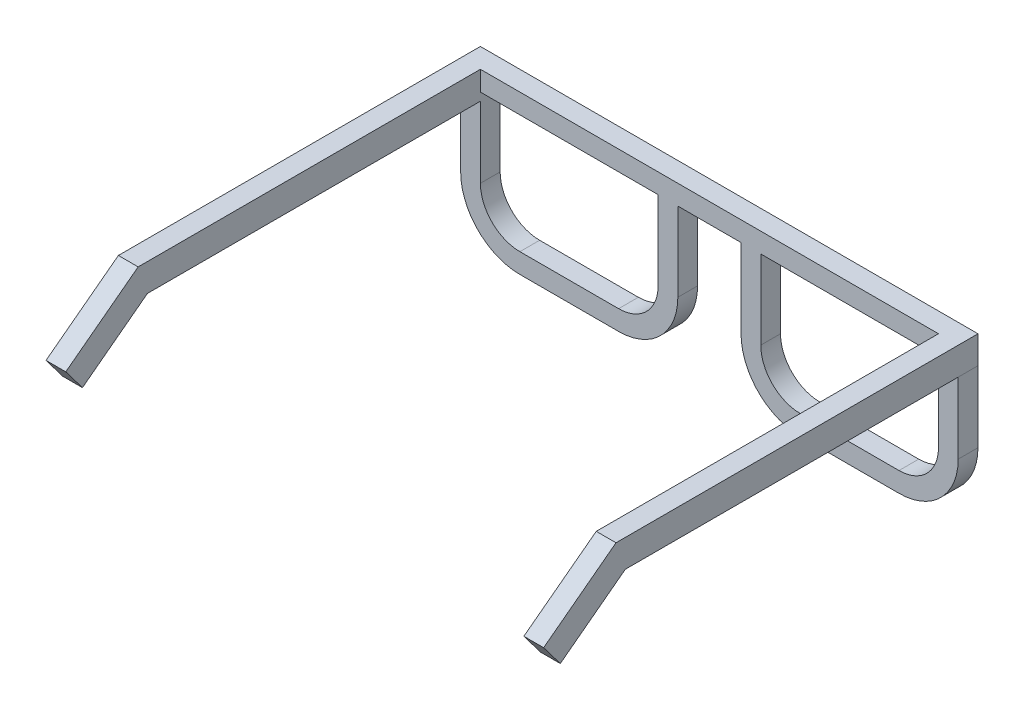
from build123d import *

# Parameters (mm, degrees)
SKETCH_1_W      = 55
SKETCH_1_H      = 40
SKETCH_1_W_2    = 45
SKETCH_1_H_2    = 30
SKETCH_1_W_3    = 16
SKETCH_1_H_3    = 5
EXTRUDE_1_DEPTH = 5
FILLET_1_R      = 10
FILLET_2_R      = 15
EXTRUDE_START   = -5
SKETCH_2_W      = 5
SKETCH_2_H      = 7
EXTRUDE_2_DEPTH = 5.01
FILLET_3_R      = 15


with BuildPart() as part:
    # ｽｹｯﾁ1 → ﾎﾞｽ - 押し出し1 (new body)
    # profile 1 of 3: a face of its own
    with BuildSketch(Plane.XY):
        with Locations((35.5, 1.53340789)):
            Rectangle(SKETCH_1_W, SKETCH_1_H)
        with Locations((35.5, 1.53340789)):
            Rectangle(SKETCH_1_W_2, SKETCH_1_H_2, mode=Mode.SUBTRACT)
    # profile 2 of 3: a face of its own
    with BuildSketch(Plane.XY):
        with Locations((0, 19.03340789)):
            Rectangle(SKETCH_1_W_3, SKETCH_1_H_3)
    # profile 3 of 3: a face of its own
    with BuildSketch(Plane.XY):
        with Locations((-35.5, 1.53340789)):
            Rectangle(SKETCH_1_W, SKETCH_1_H)
        with Locations((-35.5, 1.53340789)):
            Rectangle(SKETCH_1_W_2, SKETCH_1_H_2, mode=Mode.SUBTRACT)
    extrude_1 = extrude(amount=EXTRUDE_1_DEPTH)

    # ﾌｨﾚｯﾄ1
    fillet_1_edges = [part.edges().sort_by_distance(p)[0] for p in [
        (-58, -13.46659211, 2.5),
        (-13, -13.46659211, 2.5),
        (13, -13.46659211, 2.5),
        (58, -13.46659211, 2.5),
    ]]
    fillet(fillet_1_edges, radius=FILLET_1_R)

    # ﾌｨﾚｯﾄ2
    fillet_2_edges = [part.edges().sort_by_distance(p)[0] for p in [
        (63, -18.46659211, 2.5),
        (8, -18.46659211, 2.5),
        (-8, -18.46659211, 2.5),
        (-63, -18.46659211, 2.5),
    ]]
    fillet(fillet_2_edges, radius=FILLET_2_R)

    # ｽｹｯﾁ2 → ﾎﾞｽ - 押し出し2 (add)
    with BuildSketch(Plane.ZY.offset(63).offset(EXTRUDE_START)):
        with Locations((2.5, 18.03340789)):
            Rectangle(SKETCH_2_W, SKETCH_2_H)
        Polygon((87.451237669, 15.948400854), (91.671154304, 21.53340789), (5, 21.53340789), (5, 14.53340789), (89.323963209, 14.53340789), align=None)
        Polygon((91.671154304, 14.53340789), (91.671154304, 21.53340789), (87.451237669, 15.948400854), (89.323963209, 14.53340789), align=None)
        Polygon((110, 7.684508442), (91.671154304, 21.53340789), (91.671154304, 14.53340789), (89.323963209, 14.53340789), (105.780083365, 2.099501406), align=None)
    extrude_2 = extrude(amount=EXTRUDE_2_DEPTH)

    # ﾐﾗｰ1: ﾎﾞｽ - 押し出し1, ﾎﾞｽ - 押し出し2 across plane
    add(extrude_1.mirror(Plane(origin=(0, 0, 0), x_dir=(0, 0, 1), z_dir=(1, 0, 0))))
    add(extrude_2.mirror(Plane(origin=(0, 0, 0), x_dir=(0, 0, 1), z_dir=(1, 0, 0))))

    # ﾌｨﾚｯﾄ3
    fillet_3_edges = [part.edges().sort_by_distance(p)[0] for p in [
        (63, -18.46659211, 2.5),
        (-8, -18.46659211, 2.5),
        (-63, -18.46659211, 2.5),
        (8, -18.46659211, 2.5),
    ]]
    fillet(fillet_3_edges, radius=FILLET_3_R)


solid = part.part
